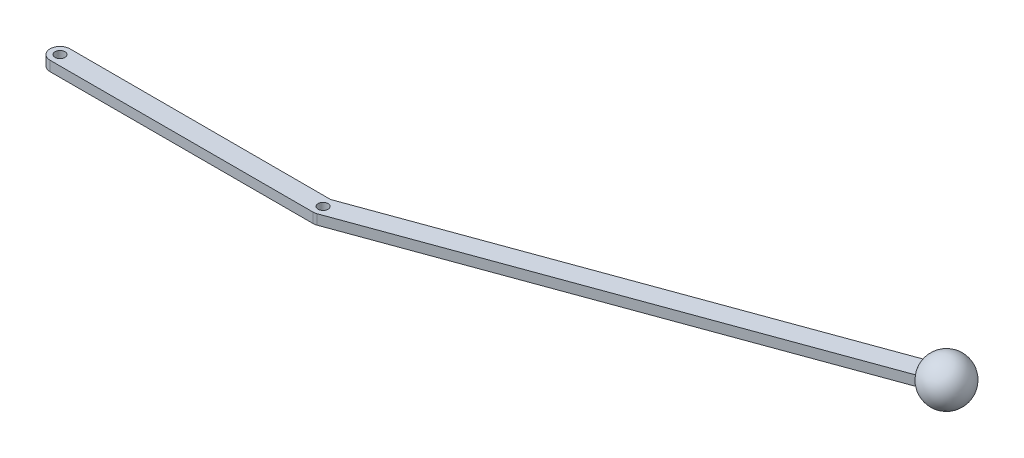
from build123d import *

# Parameters (mm, degrees)
SKETCH1_R           = 5
BOSS_EXTRUDE1_DEPTH = 5
SKETCH2_R           = 5
BOSS_EXTRUDE2_DEPTH = 5


with BuildPart() as part:
    # Sketch1 → Boss-Extrude1 (new, symmetric)
    with BuildSketch(Plane(origin=(0, 0, 0), x_dir=(1, 0, 0), z_dir=(0, 1, 0))):
        with BuildLine():
            ThreePointArc((3.420201433, -9.396926208), (1.736481777, -9.84807753), (0, -10))
            Line((0, -10), (-265, -10))
            ThreePointArc((-265, -10), (-275, 0), (-265, 10))
            Line((-265, 10), (-2.224544129, 9.832109877))
            Line((-2.224544129, 9.832109877), (457.029182752, 176.986796437))
            ThreePointArc((457.029182752, 176.986796437), (469.846310393, 171.010071663), (463.869585618, 158.192944022))
            Line((463.869585618, 158.192944022), (3.420201433, -9.396926208))
        make_face()
        with Locations(Location((460.449384185, 167.58987023, 0), (0, 0, 270))):
            Circle(SKETCH1_R, mode=Mode.SUBTRACT)
        with Locations(Location((0, 0, 0), (0, 0, 270))):
            Circle(SKETCH1_R, mode=Mode.SUBTRACT)
        with Locations(Location((-265, 0, 0), (0, 0, 270))):
            Circle(SKETCH1_R, mode=Mode.SUBTRACT)
    extrude(amount=BOSS_EXTRUDE1_DEPTH, both=True)

    # Sketch2 → Boss-Extrude2 (add, symmetric)
    with BuildSketch(Plane(origin=(0, 0, 0), x_dir=(1, 0, 0), z_dir=(0, 1, 0))):
        with Locations((460.449384185, 167.58987023)):
            Circle(SKETCH2_R)
    extrude(amount=BOSS_EXTRUDE2_DEPTH, both=True)

    # Sketch3 → Revolve1 (revolve)
    with BuildSketch(Plane(origin=(0, 0, 0), x_dir=(1, 0, 0), z_dir=(0, 1, 0))):
        with BuildLine():
            Line((453.692605533, 189.051369298), (467.206162837, 146.128371161))
            ThreePointArc((467.206162837, 146.128371161), (481.910883253, 174.346648881), (453.692605533, 189.051369298))
        make_face()
    revolve(axis=Axis((453.692605533, 0, -189.051369298), (0.30030127341076346, 0, 0.9538444030280169)))


solid = part.part
